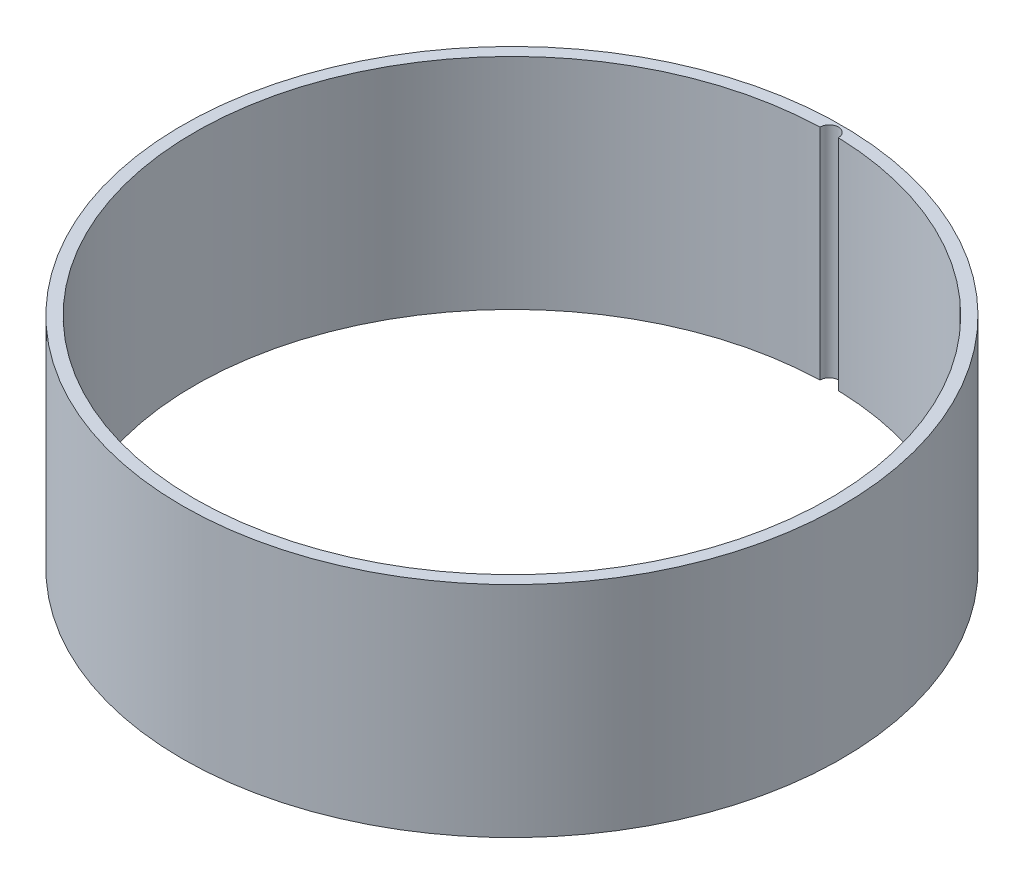
from build123d import *

# Parameters (mm, degrees)
SKICA1_R                = 27
P_IDAT_VYSUNUT_M1_DEPTH = 17.95


with BuildPart() as part:
    # Skica1 → Přidat vysunutím1 (new body)
    with BuildSketch(Plane(origin=(0, 0, 0), x_dir=(1, 0, 0), z_dir=(0, 1, 0))):
        with Locations(Location((0, 0, 0), (0, 0, 270))):
            Circle(SKICA1_R)
        with BuildLine():
            ThreePointArc((-0.749921987, 25.989182692), (0, -26), (0.749921987, 25.989182692))
            ThreePointArc((0.749921987, 25.989182692), (0, 26.75), (-0.749921987, 25.989182692))
        make_face(mode=Mode.SUBTRACT)
    extrude(amount=P_IDAT_VYSUNUT_M1_DEPTH)


solid = part.part
